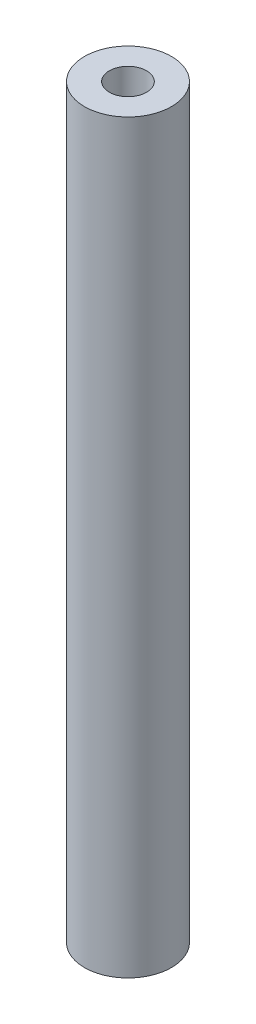
from build123d import *

# Parameters (mm, degrees)
SKETCH1_R           = 3.5
SKETCH1_R_2         = 1.5
BOSS_EXTRUDE1_DEPTH = 60


with BuildPart() as part:
    # Sketch1 → Boss-Extrude1 (new body)
    with BuildSketch(Plane(origin=(0, 0, 0), x_dir=(1, 0, 0), z_dir=(0, 1, 0))):
        with Locations(Location((0, 0, 0), (0, 0, 270))):
            Circle(SKETCH1_R)
        with Locations(Location((0, 0, 0), (0, 0, 270))):
            Circle(SKETCH1_R_2, mode=Mode.SUBTRACT)
    extrude(amount=BOSS_EXTRUDE1_DEPTH)


solid = part.part
